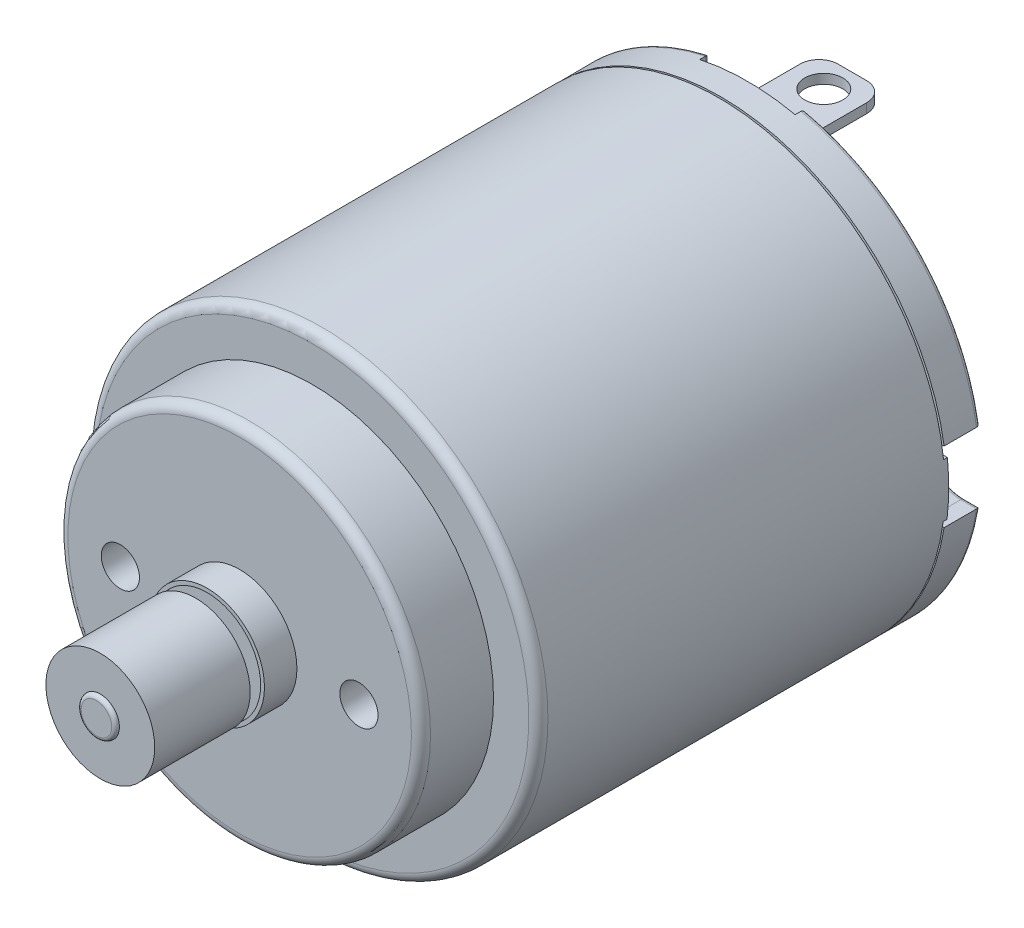
from build123d import *
from build123d.topology import SkipClean

# Parameters (mm, degrees)
RESSALTO_EXTRUS_O1_DEPTH      = 30
RESSALTO_EXTRUS_O1_DEPTH_BACK = 5
ESBO_O1_R                     = 1
ESBO_O2_R                     = 9.5
RESSALTO_EXTRUS_O2_DEPTH      = 27.1
ESBO_O3_R                     = 3
RESSALTO_EXTRUS_O3_DEPTH      = 1.7
ESBO_O4_R                     = 11.85
RESSALTO_EXTRUS_O4_DEPTH      = 23.3
ESBO_O5_R                     = 4.15
RESSALTO_EXTRUS_O5_DEPTH      = 2
ESBO_O6_W                     = 3.5
ESBO_O6_H                     = 0.5
RESSALTO_EXTRUS_O6_DEPTH      = 5
ESBO_O7_R                     = 1
CORTE_EXTRUS_O1_DEPTH         = 4
ESBO_O8_R                     = 1
CORTE_EXTRUS_O2_DEPTH         = 4
FILETE1_R                     = 1
CORTE_EXTRUS_O3_DEPTH         = 15
CORTE_EXTRUS_O3_DEPTH_BACK    = 38
ESBO_O9_R                     = 1
ESBO_O10_W                    = 2
ESBO_O10_H                    = 9.327126009
CORTE_EXTRUS_O4_DEPTH         = 2
CORTE_EXTRUS_O5_DEPTH         = 0.5
CORTE_EXTRUS_O6_DEPTH         = 2
FILETE3_R                     = 0.5
ESBO_O15_R                    = 2.8
CORTE_EXTRUS_O8_DEPTH         = 0.1
CORTE_EXTRUS_O9_DEPTH         = 5
CORTE_EXTRUS_O9_DEPTH_BACK    = 2
RESSALTO_EXTRUS_O8_DEPTH      = 0.2
CORTE_EXTRUS_O10_DEPTH        = 2
CORTE_EXTRUS_O10_DEPTH_BACK   = 48
ESBO_O19_R                    = 1
ESBO_O20_R                    = 1
RESSALTO_EXTRUS_O11_DEPTH     = 38
FILETE4_R                     = 0.2
ESBO_O18_R                    = 2.85
ESBO_O18_R_2                  = 1
RESSALTO_EXTRUS_O13_DEPTH     = 5
CORTE_EXTRUS_O11_DEPTH        = 0.1
ESBO_O13_W                    = 3.5
ESBO_O13_H                    = 0.5
RESSALTO_EXTRUS_O14_DEPTH     = 1
FILETE5_R                     = 0.2


with BuildPart() as part:
    # Esboço1 → Ressalto-extrusão1 (new, two sides: drawn at the far end of the back side and taken through both)
    with BuildSketch(Plane.XY.offset(-RESSALTO_EXTRUS_O1_DEPTH_BACK)):
        Circle(ESBO_O1_R)
    extrude(amount=RESSALTO_EXTRUS_O1_DEPTH + RESSALTO_EXTRUS_O1_DEPTH_BACK)

    # Esboço2 → Ressalto-extrusão2 (add)
    with BuildSketch(Plane.XY.offset(20)):
        Circle(ESBO_O2_R)
    extrude(amount=-RESSALTO_EXTRUS_O2_DEPTH)

    # Esboço3 → Ressalto-extrusão3 (add)
    with BuildSketch(Plane.XY.offset(20)):
        Circle(ESBO_O3_R)
    extrude(amount=RESSALTO_EXTRUS_O3_DEPTH)

    # Esboço4 → Ressalto-extrusão4 (add)
    with BuildSketch(Plane(origin=(0, 0, -7.1), x_dir=(-1, 0, 0), z_dir=(0, 0, -1))):
        Circle(ESBO_O4_R)
    extrude(amount=-RESSALTO_EXTRUS_O4_DEPTH)

    # Esboço5 → Ressalto-extrusão5 (add)
    with BuildSketch(Plane(origin=(0, 0, -7.1), x_dir=(-1, 0, 0), z_dir=(0, 0, -1))):
        Circle(ESBO_O5_R)
    extrude(amount=RESSALTO_EXTRUS_O5_DEPTH)

    # Esboço6 → Ressalto-extrusão6 (add)
    with BuildSketch(Plane(origin=(0, 0, -7.1), x_dir=(-1, 0, 0), z_dir=(0, 0, -1))):
        with Locations((0, 9.25)):
            Rectangle(ESBO_O6_W, ESBO_O6_H)
        with Locations((0, -9.25)):
            Rectangle(ESBO_O6_W, ESBO_O6_H)
    extrude(amount=RESSALTO_EXTRUS_O6_DEPTH)

    # Esboço7 → Corte-extrusão1 (cut)
    with BuildSketch(Plane(origin=(0, 9.5, 0), x_dir=(1, 0, 0), z_dir=(0, 1, 0))):
        with Locations(Location((0, 10.6, 0), (0, 0, 270))):
            Circle(ESBO_O7_R)
    extrude(amount=-CORTE_EXTRUS_O1_DEPTH, mode=Mode.SUBTRACT)

    # Esboço8 → Corte-extrusão2 (cut)
    with BuildSketch(Plane(origin=(0, -9, 0), x_dir=(1, 0, 0), z_dir=(0, 1, 0))):
        with Locations(Location((0, 10.6, 0), (0, 0, 270))):
            Circle(ESBO_O8_R)
    extrude(amount=-CORTE_EXTRUS_O2_DEPTH, mode=Mode.SUBTRACT)

    # Filete1
    filete1_edges = [part.edges().sort_by_distance(p)[0] for p in [
        (1.75, 9.25, -12.1),
        (-1.75, 9.25, -12.1),
        (1.75, -9.25, -12.1),
        (-1.75, -9.25, -12.1),
    ]]
    fillet(filete1_edges, radius=FILETE1_R)

    # Esboço9 → Corte-extrusão3 (cut, two sides: drawn at the far end of the back side and taken through both)
    with BuildSketch(Plane(origin=(0, 0, -7.1), x_dir=(-1, 0, 0), z_dir=(0, 0, -1)).offset(-CORTE_EXTRUS_O3_DEPTH_BACK)):
        with Locations(Location((-6.25, 0, 0), (0, 0, 180))):
            Circle(ESBO_O9_R)
        with Locations(Location((6.25, 0, 0), (0, 0, 180))):
            Circle(ESBO_O9_R)
    extrude(amount=CORTE_EXTRUS_O3_DEPTH + CORTE_EXTRUS_O3_DEPTH_BACK, mode=Mode.SUBTRACT)

    # Esboço10 → Corte-extrusão4 (cut)
    with BuildSketch(Plane(origin=(0, 0, -9.1), x_dir=(-1, 0, 0), z_dir=(0, 0, -1))):
        with Locations((4.75, -0.245450684)):
            Rectangle(ESBO_O10_W, ESBO_O10_H)
    extrude(amount=-CORTE_EXTRUS_O4_DEPTH, mode=Mode.SUBTRACT)

    # Esboço11 → Corte-extrusão5 (cut)
    with BuildSketch(Plane(origin=(0, 0, -7.1), x_dir=(-1, 0, 0), z_dir=(0, 0, -1))):
        with BuildLine():
            Line((-4.266145802, 1.85), (-8.654478609, 1.85))
            ThreePointArc((-8.654478609, 1.85), (-6.490493994, 6.016310141), (-2.5, 8.489552403))
            Line((-2.5, 8.489552403), (-2.5, 12.567039085))
            Line((-2.5, 12.567039085), (2.5, 12.567039085))
            Line((2.5, 12.567039085), (2.5, 8.489552403))
            ThreePointArc((2.5, 8.489552403), (6.490493994, 6.016310141), (8.654478609, 1.85))
            Line((8.654478609, 1.85), (4.266145802, 1.85))
            ThreePointArc((4.266145802, 1.85), (0, 4.65), (-4.266145802, 1.85))
        make_face()
        with BuildLine():
            Line((2.5, -12.567039085), (-2.5, -12.567039085))
            Line((-2.5, -12.567039085), (-2.5, -8.489552403))
            ThreePointArc((-2.5, -8.489552403), (-6.490493994, -6.016310141), (-8.654478609, -1.85))
            Line((-8.654478609, -1.85), (-4.266145802, -1.85))
            ThreePointArc((-4.266145802, -1.85), (0, -4.65), (4.266145802, -1.85))
            Line((4.266145802, -1.85), (8.654478609, -1.85))
            ThreePointArc((8.654478609, -1.85), (6.490493994, -6.016310141), (2.5, -8.489552403))
            Line((2.5, -8.489552403), (2.5, -12.567039085))
        make_face()
    extrude(amount=-CORTE_EXTRUS_O5_DEPTH, mode=Mode.SUBTRACT)


with BuildPart() as corte_extrus_o5_piece_1:
    # of the separate pieces the step leaves, piece 1, a body of its own (corte_extrus_o5_pieces)
    add(part.part.solids().sort_by_distance((-2.5, -11.583285372, -7.1))[0])

    # Esboço12 → Corte-extrusão6 (cut)
    with BuildSketch(Plane(origin=(0, 0, -6.6), x_dir=(-1, 0, 0), z_dir=(0, 0, -1))):
        with BuildLine():
            Line((1.710100717, -4.698463104), (2.05212086, -5.638155725))
            ThreePointArc((2.05212086, -5.638155725), (4.053541246, -4.423664021), (5.437846722, -2.53570957))
            Line((5.437846722, -2.53570957), (4.531538935, -2.113091309))
            ThreePointArc((4.531538935, -2.113091309), (3.377951038, -3.686386684), (1.710100717, -4.698463104))
        make_face()
        with BuildLine():
            Line((-1.710100717, 4.698463104), (-2.05212086, 5.638155725))
            ThreePointArc((-2.05212086, 5.638155725), (-4.053541246, 4.423664021), (-5.437846722, 2.53570957))
            Line((-5.437846722, 2.53570957), (-4.531538935, 2.113091309))
            ThreePointArc((-4.531538935, 2.113091309), (-3.377951038, 3.686386684), (-1.710100717, 4.698463104))
        make_face()
    extrude(amount=-CORTE_EXTRUS_O6_DEPTH, mode=Mode.SUBTRACT)

    # Filete3
    filete3_edges = [corte_extrus_o5_piece_1.edges().sort_by_distance(p)[0] for p in [
        (-9.5, 0, 20),
        (11.85, 0, 16.2),
    ]]
    fillet(filete3_edges, radius=FILETE3_R)

    # Esboço15 → Corte-extrusão8 (cut)
    with BuildSketch(Plane.XY.offset(21.7)):
        Circle(ESBO_O15_R)
    extrude(amount=-CORTE_EXTRUS_O8_DEPTH, mode=Mode.SUBTRACT)


with BuildPart() as corte_extrus_o5_piece_2:
    # of the separate pieces the step leaves, piece 2, a body of its own (corte_extrus_o5_pieces)
    add(part.part.solids().sort_by_distance((-1.75, -9, -11.1))[0])



with BuildPart() as corte_extrus_o5_piece_3:
    # of the separate pieces the step leaves, piece 3, a body of its own (corte_extrus_o5_pieces)
    add(part.part.solids().sort_by_distance((-1.75, 9.5, -11.1))[0])


with BuildPart() as corte_extrus_o8_piece_1:
    # of the separate pieces the step leaves, piece 1, a body of its own (corte_extrus_o8_pieces)
    add(corte_extrus_o5_piece_1.part.solids().sort_by_distance((-11.85, 0, 15.7))[0])

    # Esboço16 → Corte-extrusão9 (cut, two sides: drawn at the far end of the back side and taken through both)
    with BuildSketch(Plane(origin=(0, 0, -7.1), x_dir=(-1, 0, 0), z_dir=(0, 0, -1)).offset(-CORTE_EXTRUS_O9_DEPTH_BACK)):
        with BuildLine():
            Line((10.873677066, -1.85), (11.704699911, -1.85))
            ThreePointArc((11.704699911, -1.85), (11.85, 0), (11.704699911, 1.85))
            Line((11.704699911, 1.85), (10.873677066, 1.85))
            ThreePointArc((10.873677066, 1.85), (9.023677066, 0), (10.873677066, -1.85))
        make_face()
        with BuildLine():
            Line((-10.873677066, 1.85), (-11.704699911, 1.85))
            ThreePointArc((-11.704699911, 1.85), (-11.85, 0), (-11.704699911, -1.85))
            Line((-11.704699911, -1.85), (-10.873677066, -1.85))
            ThreePointArc((-10.873677066, -1.85), (-9.023677066, 0), (-10.873677066, 1.85))
        make_face()
    extrude(amount=CORTE_EXTRUS_O9_DEPTH + CORTE_EXTRUS_O9_DEPTH_BACK, mode=Mode.SUBTRACT)

    # Esboço17 → Ressalto-extrusão8 (add)
    with SkipClean():  # the faces are left unmerged after this step: merging them gives an invalid solid
        with BuildSketch(Plane(origin=(0, 0, -5.1), x_dir=(-1, 0, 0), z_dir=(0, 0, -1))):
            with BuildLine():
                Line((-10.214955347, 1.317232401), (-11.776561417, 1.317232401))
                ThreePointArc((-11.776561417, 1.317232401), (-11.849642581, -0.092036399), (-11.754679919, -1.5))
                Line((-11.754679919, -1.5), (-10.184240637, -1.5))
                Line((-10.184240637, -1.5), (-9.986420995, -1.300011885))
                Line((-9.986420995, -1.300011885), (-10.012774988, 1.117244286))
                Line((-10.012774988, 1.117244286), (-10.214955347, 1.317232401))
            make_face()
            with BuildLine():
                Line((10.012774988, 1.117244286), (9.986420995, -1.300011885))
                Line((9.986420995, -1.300011885), (10.184240637, -1.5))
                Line((10.184240637, -1.5), (11.754679919, -1.5))
                ThreePointArc((11.754679919, -1.5), (11.849642581, -0.092036399), (11.776561417, 1.317232401))
                Line((11.776561417, 1.317232401), (10.214955347, 1.317232401))
                Line((10.214955347, 1.317232401), (10.012774988, 1.117244286))
            make_face()
        extrude(amount=RESSALTO_EXTRUS_O8_DEPTH)


with BuildPart() as corte_extrus_o8_piece_2:
    # of the separate pieces the step leaves, piece 2, a body of its own (corte_extrus_o8_pieces)
    add(corte_extrus_o5_piece_1.part.solids().sort_by_distance((1, 0, 21.7))[0])


with BuildPart() as corte_extrus_o10_tool:
    # Esboço19 → Corte-extrusão10 (new, two sides: drawn at the far end of the back side and taken through both)
    with SkipClean():  # the faces are left unmerged after this step: merging them gives an invalid solid
        with BuildSketch(Plane.XY.offset(30).offset(-CORTE_EXTRUS_O10_DEPTH_BACK)):
            with Locations(Location((0, 0, 0), (0, 0, 180))):
                Circle(ESBO_O19_R)
        extrude(amount=CORTE_EXTRUS_O10_DEPTH + CORTE_EXTRUS_O10_DEPTH_BACK)


with BuildPart() as corte_extrus_o8_piece_1_1:
    with SkipClean():  # the faces are left unmerged after this step: merging them gives an invalid solid
        add(corte_extrus_o8_piece_1.part)

        # Corte-extrusão10: cut by corte_extrus_o10_tool
        add(corte_extrus_o10_tool.part, mode=Mode.SUBTRACT)

    # Esboço20 → Ressalto-extrusão11 (add)
    with SkipClean():  # the faces are left unmerged after this step: merging them gives an invalid solid
        with BuildSketch(Plane(origin=(0, 0, -10.5), x_dir=(-1, 0, 0), z_dir=(0, 0, -1))):
            Circle(ESBO_O20_R)
        extrude(amount=-RESSALTO_EXTRUS_O11_DEPTH)

    # Filete4
    filete4_edges = [corte_extrus_o8_piece_1_1.edges().sort_by_distance(p)[0] for p in [
        (1, 0, 27.5),
        (1, 0, -10.5),
    ]]
    fillet(filete4_edges, radius=FILETE4_R)

    # Esboço18 → Ressalto-extrusão13 (add)
    with SkipClean():  # the faces are left unmerged after this step: merging them gives an invalid solid
        with BuildSketch(Plane.XY.offset(27.3)):
            Circle(ESBO_O18_R)
            Circle(ESBO_O18_R_2, mode=Mode.SUBTRACT)
        extrude(amount=-RESSALTO_EXTRUS_O13_DEPTH)

    # Esboço14 → Corte-extrusão11 (cut)
    with SkipClean():  # the faces are left unmerged after this step: merging them gives an invalid solid
        with BuildSketch(Plane(origin=(0, 0, -5.1), x_dir=(-1, 0, 0), z_dir=(0, 0, -1))):
            with BuildLine():
                Line((11.907140715, 1.85), (11.502173708, 1.85))
                ThreePointArc((11.502173708, 1.85), (0, 11.65), (-11.502173708, 1.85))
                Line((-11.502173708, 1.85), (-11.907140715, 1.85))
                ThreePointArc((-11.907140715, 1.85), (0, 12.05), (11.907140715, 1.85))
            make_face()
            with BuildLine():
                Line((11.907140715, -1.85), (11.502173708, -1.85))
                ThreePointArc((11.502173708, -1.85), (0, -11.65), (-11.502173708, -1.85))
                Line((-11.502173708, -1.85), (-11.907140715, -1.85))
                ThreePointArc((-11.907140715, -1.85), (0, -12.05), (11.907140715, -1.85))
            make_face()
        extrude(amount=CORTE_EXTRUS_O11_DEPTH, mode=Mode.SUBTRACT)


with BuildPart() as corte_extrus_o8_piece_2_1:
    with SkipClean():  # the faces are left unmerged after this step: merging them gives an invalid solid
        add(corte_extrus_o8_piece_2.part)

        # Corte-extrusão10: cut by corte_extrus_o10_tool
        add(corte_extrus_o10_tool.part, mode=Mode.SUBTRACT)


with BuildPart() as corte_extrus_o5_piece_2_1:
    with SkipClean():  # the faces are left unmerged after this step: merging them gives an invalid solid
        add(corte_extrus_o5_piece_2.part)

        add(corte_extrus_o5_piece_3.part)  # Ressalto-extrusão14 merges Corte-extrusão5 piece 3

        add(corte_extrus_o8_piece_1_1.part)  # Ressalto-extrusão14 merges Corte-extrusão8 piece 1
        # Esboço13 → Ressalto-extrusão14 (add)
        with BuildSketch(Plane.XY.offset(-6.6)):
            with Locations((0, -9.25)):
                Rectangle(ESBO_O13_W, ESBO_O13_H)
            with Locations((0, 9.25)):
                Rectangle(ESBO_O13_W, ESBO_O13_H)
        extrude(amount=-RESSALTO_EXTRUS_O14_DEPTH)

    # Filete5
    filete5_edges = [corte_extrus_o5_piece_2_1.edges().sort_by_distance(p)[0] for p in [
        (-8.609737854, 8.142168881, -7.1),
        (8.609737854, 8.142168881, -7.1),
        (8.609737854, -8.142168881, -7.1),
        (-8.609737854, -8.142168881, -7.1),
        (4.15, 0, -9.1),
        (-3.75, 0, -9.1),
        (2.5, 10.036418887, -7.1),
        (-2.5, 10.036418887, -7.1),
        (-6.490493994, 6.016310141, -7.1),
        (-6.460312205, 1.85, -7.1),
        (0, 4.65, -7.1),
        (6.460312205, 1.85, -7.1),
        (6.490493994, 6.016310141, -7.1),
        (0, -4.65, -7.1),
        (-6.460312205, -1.85, -7.1),
        (-6.490493994, -6.016310141, -7.1),
        (-2.5, -10.036418887, -7.1),
        (2.5, -10.036418887, -7.1),
        (6.490493994, -6.016310141, -7.1),
        (6.460312205, -1.85, -7.1),
        (9.023677066, 0, -7.1),
        (11.289188488, 1.85, -7.1),
        (11.289188488, -1.85, -7.1),
        (-9.023677066, 0, -7.1),
        (-11.289188488, -1.85, -7.1),
        (-11.289188488, 1.85, -7.1),
        (1, 0, -9.1),
    ]]
    fillet(filete5_edges, radius=FILETE5_R)


solid = corte_extrus_o5_piece_2_1.part
